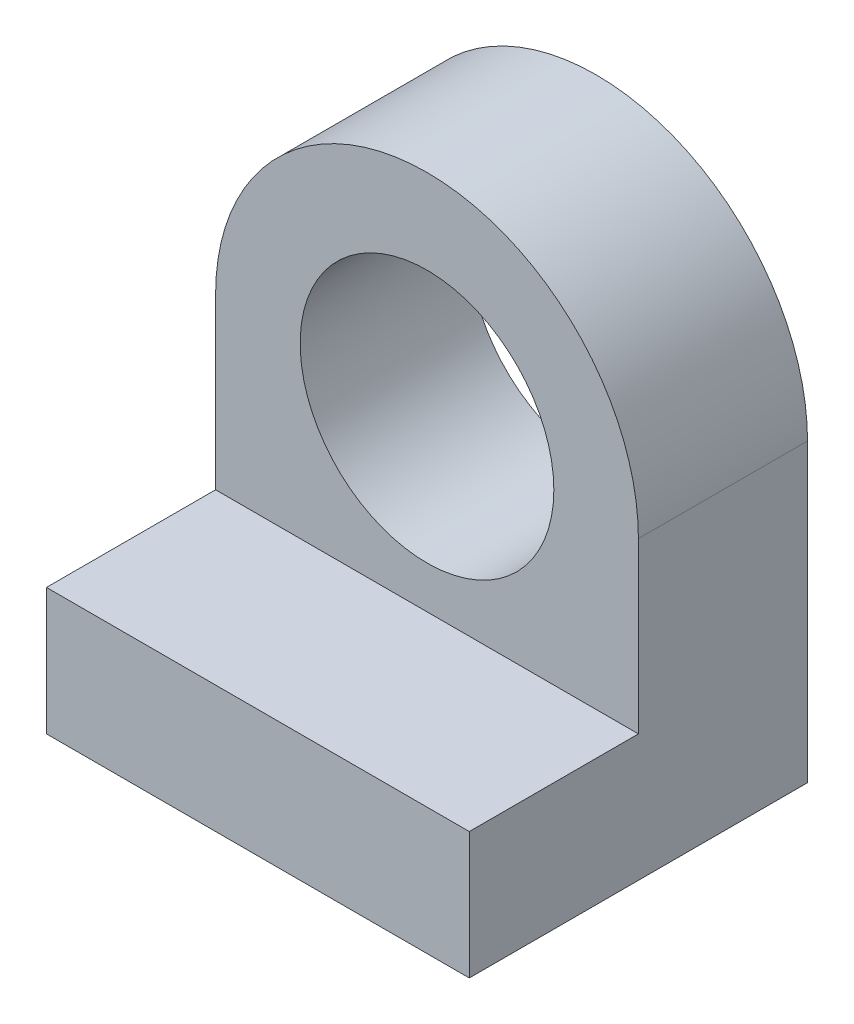
from build123d import *

# Parameters (mm, degrees)
CROQUIS1_W              = 25
CROQUIS1_H              = 7.5
SALIENTE_EXTRUIR1_DEPTH = 20
CROQUIS8_R              = 7.5
SALIENTE_EXTRUIR6_DEPTH = 10


with BuildPart() as part:
    # Croquis1 → Saliente-Extruir1 (new body)
    with BuildSketch(Plane.XY):
        with Locations((0, 3.75)):
            Rectangle(CROQUIS1_W, CROQUIS1_H)
    extrude(amount=-SALIENTE_EXTRUIR1_DEPTH)

    # Croquis8 → Saliente-Extruir6 (add)
    with BuildSketch(Plane.XY.offset(-10)):
        with BuildLine():
            Line((-12.5, 17.5), (-12.5, 7.5))
            Line((-12.5, 7.5), (12.5, 7.5))
            Line((12.5, 7.5), (12.5, 17.5))
            ThreePointArc((12.5, 17.5), (0, 30), (-12.5, 17.5))
        make_face()
        with Locations((0, 17.5)):
            Circle(CROQUIS8_R, mode=Mode.SUBTRACT)
    extrude(amount=-SALIENTE_EXTRUIR6_DEPTH)


solid = part.part
